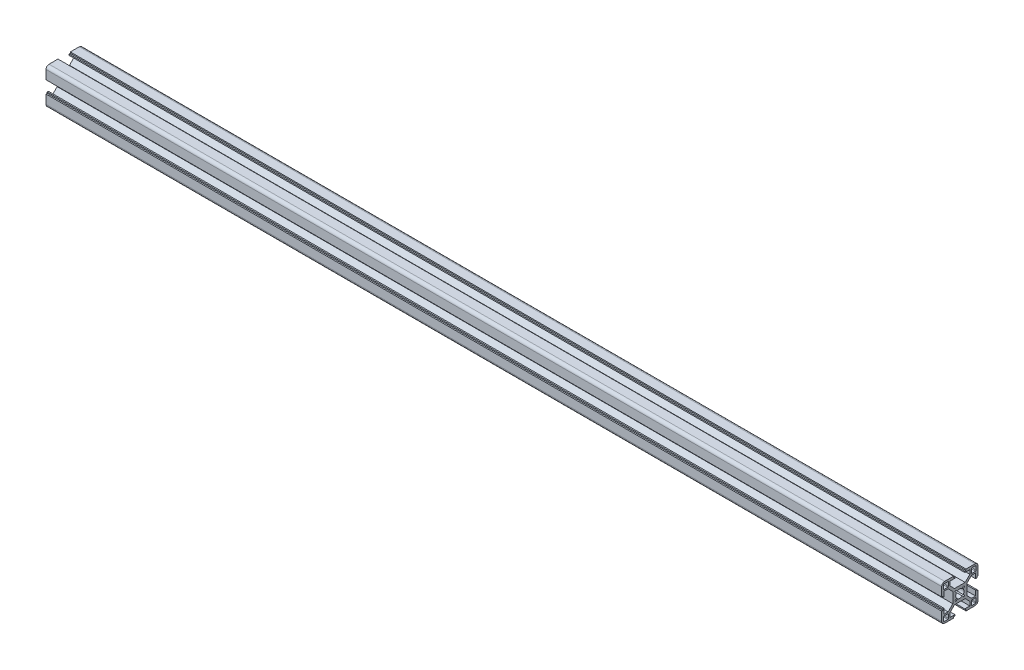
from build123d import *

# Parameters (mm, degrees)
EXTRUDE_1_DEPTH     = 50
EXTRUDE_2_DEPTH     = 740
CUT_EXTRUDE_START   = 15.049571
SKETCH_4_R          = 3
CUT_EXTRUDE_1_DEPTH = 30


with BuildPart() as part:
    # 草图1 → 凸台-拉伸1 (new body)
    with BuildSketch(Plane(origin=(0, 0, 0), x_dir=(0, 0, -1), z_dir=(1, 0, 0))):
        with BuildLine():
            Line((-5.14957074, -13.70467014), (-4.14957074, -13.70467014))
            Line((-4.14957074, -13.70467014), (-4.14957074, -12.70467014))
            Line((-4.14957074, -12.70467014), (-8.29957074, -12.70467014))
            Line((-8.29957074, -12.70467014), (-8.29957074, -9.3688837))
            Line((-8.29957074, -9.3688837), (-4.43535718, -5.50467014))
            Line((-4.43535718, -5.50467014), (4.3362157, -5.50467014))
            Line((4.3362157, -5.50467014), (8.20042926, -9.3688837))
            Line((8.20042926, -9.3688837), (8.20042926, -12.70467014))
            Line((8.20042926, -12.70467014), (4.05042926, -12.70467014))
            Line((4.05042926, -12.70467014), (4.05042926, -13.70467014))
            Line((4.05042926, -13.70467014), (5.05042926, -13.70467014))
            Line((5.05042926, -13.70467014), (5.05042926, -14.70467014))
            Line((5.05042926, -14.70467014), (12.45042926, -14.70467014))
            ThreePointArc((12.45042926, -14.70467014), (14.218196213, -13.972437093), (14.95042926, -12.20467014))
            Line((14.95042926, -12.20467014), (14.95042926, -4.80467014))
            Line((14.95042926, -4.80467014), (13.95042926, -4.80467014))
            Line((13.95042926, -4.80467014), (13.95042926, -3.80467014))
            Line((13.95042926, -3.80467014), (12.95042926, -3.80467014))
            Line((12.95042926, -3.80467014), (12.95042926, -7.95467014))
            Line((12.95042926, -7.95467014), (9.61464282, -7.95467014))
            Line((9.61464282, -7.95467014), (5.75042926, -4.09045658))
            Line((5.75042926, -4.09045658), (5.75042926, 4.6811163))
            Line((5.75042926, 4.6811163), (9.61464282, 8.54532986))
            Line((9.61464282, 8.54532986), (12.95042926, 8.54532986))
            Line((12.95042926, 8.54532986), (12.95042926, 4.39532986))
            Line((12.95042926, 4.39532986), (13.95042926, 4.39532986))
            Line((13.95042926, 4.39532986), (13.95042926, 5.39532986))
            Line((13.95042926, 5.39532986), (14.95042926, 5.39532986))
            Line((14.95042926, 5.39532986), (14.95042926, 12.79532986))
            ThreePointArc((14.95042926, 12.79532986), (14.218196213, 14.563096813), (12.45042926, 15.29532986))
            Line((12.45042926, 15.29532986), (5.05042926, 15.29532986))
            Line((5.05042926, 15.29532986), (5.05042926, 14.29532986))
            Line((5.05042926, 14.29532986), (4.05042926, 14.29532986))
            Line((4.05042926, 14.29532986), (4.05042926, 13.29532986))
            Line((4.05042926, 13.29532986), (8.20042926, 13.29532986))
            Line((8.20042926, 13.29532986), (8.20042926, 9.95954342))
            Line((8.20042926, 9.95954342), (4.3362157, 6.09532986))
            Line((4.3362157, 6.09532986), (-4.43535718, 6.09532986))
            Line((-4.43535718, 6.09532986), (-8.29957074, 9.95954342))
            Line((-8.29957074, 9.95954342), (-8.29957074, 13.29532986))
            Line((-8.29957074, 13.29532986), (-4.14957074, 13.29532986))
            Line((-4.14957074, 13.29532986), (-4.14957074, 14.29532986))
            Line((-4.14957074, 14.29532986), (-5.14957074, 14.29532986))
            Line((-5.14957074, 14.29532986), (-5.14957074, 15.29532986))
            Line((-5.14957074, 15.29532986), (-12.54957074, 15.29532986))
            ThreePointArc((-12.54957074, 15.29532986), (-14.317337693, 14.563096813), (-15.04957074, 12.79532986))
            Line((-15.04957074, 12.79532986), (-15.04957074, 5.39532986))
            Line((-15.04957074, 5.39532986), (-14.04957074, 5.39532986))
            Line((-14.04957074, 5.39532986), (-14.04957074, 4.39532986))
            Line((-14.04957074, 4.39532986), (-13.04957074, 4.39532986))
            Line((-13.04957074, 4.39532986), (-13.04957074, 8.54532986))
            Line((-13.04957074, 8.54532986), (-9.7137843, 8.54532986))
            Line((-9.7137843, 8.54532986), (-5.84957074, 4.6811163))
            Line((-5.84957074, 4.6811163), (-5.84957074, -4.09045658))
            Line((-5.84957074, -4.09045658), (-9.7137843, -7.95467014))
            Line((-9.7137843, -7.95467014), (-13.04957074, -7.95467014))
            Line((-13.04957074, -7.95467014), (-13.04957074, -3.80467014))
            Line((-13.04957074, -3.80467014), (-14.04957074, -3.80467014))
            Line((-14.04957074, -3.80467014), (-14.04957074, -4.80467014))
            Line((-14.04957074, -4.80467014), (-15.04957074, -4.80467014))
            Line((-15.04957074, -4.80467014), (-15.04957074, -12.20467014))
            ThreePointArc((-15.04957074, -12.20467014), (-14.317337693, -13.972437093), (-12.54957074, -14.70467014))
            Line((-12.54957074, -14.70467014), (-5.14957074, -14.70467014))
            Line((-5.14957074, -14.70467014), (-5.14957074, -13.70467014))
        make_face()
        with BuildLine():
            Line((-10.04957074, 9.79532986), (-13.04957074, 9.79532986))
            ThreePointArc((-13.04957074, 9.79532986), (-13.403124131, 9.941776469), (-13.54957074, 10.29532986))
            Line((-13.54957074, 10.29532986), (-13.54957074, 13.29532986))
            ThreePointArc((-13.54957074, 13.29532986), (-13.403124131, 13.648883251), (-13.04957074, 13.79532986))
            Line((-13.04957074, 13.79532986), (-10.04957074, 13.79532986))
            ThreePointArc((-10.04957074, 13.79532986), (-9.696017349, 13.648883251), (-9.54957074, 13.29532986))
            Line((-9.54957074, 13.29532986), (-9.54957074, 10.29532986))
            ThreePointArc((-9.54957074, 10.29532986), (-9.696017349, 9.941776469), (-10.04957074, 9.79532986))
        make_face(mode=Mode.SUBTRACT)
        with BuildLine():
            Line((-10.04957074, -13.20467014), (-13.04957074, -13.20467014))
            ThreePointArc((-13.04957074, -13.20467014), (-13.403124131, -13.058223531), (-13.54957074, -12.70467014))
            Line((-13.54957074, -12.70467014), (-13.54957074, -9.70467014))
            ThreePointArc((-13.54957074, -9.70467014), (-13.403124131, -9.351116749), (-13.04957074, -9.20467014))
            Line((-13.04957074, -9.20467014), (-10.04957074, -9.20467014))
            ThreePointArc((-10.04957074, -9.20467014), (-9.696017349, -9.351116749), (-9.54957074, -9.70467014))
            Line((-9.54957074, -9.70467014), (-9.54957074, -12.70467014))
            ThreePointArc((-9.54957074, -12.70467014), (-9.696017349, -13.058223531), (-10.04957074, -13.20467014))
        make_face(mode=Mode.SUBTRACT)
        with BuildLine():
            Line((12.95042926, 9.79532986), (9.95042926, 9.79532986))
            ThreePointArc((9.95042926, 9.79532986), (9.596875869, 9.941776469), (9.45042926, 10.29532986))
            Line((9.45042926, 10.29532986), (9.45042926, 13.29532986))
            ThreePointArc((9.45042926, 13.29532986), (9.596875869, 13.648883251), (9.95042926, 13.79532986))
            Line((9.95042926, 13.79532986), (12.95042926, 13.79532986))
            ThreePointArc((12.95042926, 13.79532986), (13.303982651, 13.648883251), (13.45042926, 13.29532986))
            Line((13.45042926, 13.29532986), (13.45042926, 10.29532986))
            ThreePointArc((13.45042926, 10.29532986), (13.303982651, 9.941776469), (12.95042926, 9.79532986))
        make_face(mode=Mode.SUBTRACT)
        with BuildLine():
            Line((13.45042926, -9.70467014), (13.45042926, -12.70467014))
            ThreePointArc((13.45042926, -12.70467014), (13.303982651, -13.058223531), (12.95042926, -13.20467014))
            Line((12.95042926, -13.20467014), (9.95042926, -13.20467014))
            ThreePointArc((9.95042926, -13.20467014), (9.596875869, -13.058223531), (9.45042926, -12.70467014))
            Line((9.45042926, -12.70467014), (9.45042926, -9.70467014))
            ThreePointArc((9.45042926, -9.70467014), (9.596875869, -9.351116749), (9.95042926, -9.20467014))
            Line((9.95042926, -9.20467014), (12.95042926, -9.20467014))
            ThreePointArc((12.95042926, -9.20467014), (13.303982651, -9.351116749), (13.45042926, -9.70467014))
        make_face(mode=Mode.SUBTRACT)
        with BuildLine():
            Line((-4.07998961, 3.61864195), (-3.37288283, 4.32574873))
            Line((-3.37288283, 4.32574873), (-2.07404174, 3.02690764))
            ThreePointArc((-2.07404174, 3.02690764), (-0.04957074, 3.69532986), (1.97490026, 3.02690764))
            Line((1.97490026, 3.02690764), (3.27374135, 4.32574873))
            Line((3.27374135, 4.32574873), (3.98084813, 3.61864195))
            Line((3.98084813, 3.61864195), (2.68200704, 2.31980086))
            ThreePointArc((2.68200704, 2.31980086), (3.35042926, 0.29532986), (2.68200704, -1.72914114))
            Line((2.68200704, -1.72914114), (3.98084813, -3.02798223))
            Line((3.98084813, -3.02798223), (3.27374135, -3.73508901))
            Line((3.27374135, -3.73508901), (1.97490026, -2.43624792))
            ThreePointArc((1.97490026, -2.43624792), (-0.04957074, -3.10467014), (-2.07404174, -2.43624792))
            Line((-2.07404174, -2.43624792), (-3.37288283, -3.73508901))
            Line((-3.37288283, -3.73508901), (-4.07998961, -3.02798223))
            Line((-4.07998961, -3.02798223), (-2.78114852, -1.72914114))
            ThreePointArc((-2.78114852, -1.72914114), (-3.44957074, 0.29532986), (-2.78114852, 2.31980086))
            Line((-2.78114852, 2.31980086), (-4.07998961, 3.61864195))
        make_face(mode=Mode.SUBTRACT)
    extrude(amount=-EXTRUDE_1_DEPTH)

    # 草图2 → 凸台-拉伸2 (add)
    with BuildSketch(Plane(origin=(0, 0, 0), x_dir=(0, 0, -1), z_dir=(1, 0, 0))):
        with BuildLine():
            Line((-15.04957074, -4.80467014), (-15.04957074, -12.20467014))
            ThreePointArc((-15.04957074, -12.20467014), (-14.317337693, -13.972437093), (-12.54957074, -14.70467014))
            Line((-12.54957074, -14.70467014), (-5.14957074, -14.70467014))
            Line((-5.14957074, -14.70467014), (-5.14957074, -13.70467014))
            Line((-5.14957074, -13.70467014), (-4.14957074, -13.70467014))
            Line((-4.14957074, -13.70467014), (-4.14957074, -12.70467014))
            Line((-4.14957074, -12.70467014), (-8.29957074, -12.70467014))
            Line((-8.29957074, -12.70467014), (-8.29957074, -9.3688837))
            Line((-8.29957074, -9.3688837), (-4.43535718, -5.50467014))
            Line((-4.43535718, -5.50467014), (4.3362157, -5.50467014))
            Line((4.3362157, -5.50467014), (8.20042926, -9.3688837))
            Line((8.20042926, -9.3688837), (8.20042926, -12.70467014))
            Line((8.20042926, -12.70467014), (4.05042926, -12.70467014))
            Line((4.05042926, -12.70467014), (4.05042926, -13.70467014))
            Line((4.05042926, -13.70467014), (5.05042926, -13.70467014))
            Line((5.05042926, -13.70467014), (5.05042926, -14.70467014))
            Line((5.05042926, -14.70467014), (12.45042926, -14.70467014))
            ThreePointArc((12.45042926, -14.70467014), (14.218196213, -13.972437093), (14.95042926, -12.20467014))
            Line((14.95042926, -12.20467014), (14.95042926, -4.80467014))
            Line((14.95042926, -4.80467014), (13.95042926, -4.80467014))
            Line((13.95042926, -4.80467014), (13.95042926, -3.80467014))
            Line((13.95042926, -3.80467014), (12.95042926, -3.80467014))
            Line((12.95042926, -3.80467014), (12.95042926, -7.95467014))
            Line((12.95042926, -7.95467014), (9.61464282, -7.95467014))
            Line((9.61464282, -7.95467014), (5.75042926, -4.09045658))
            Line((5.75042926, -4.09045658), (5.75042926, 4.6811163))
            Line((5.75042926, 4.6811163), (9.61464282, 8.54532986))
            Line((9.61464282, 8.54532986), (12.95042926, 8.54532986))
            Line((12.95042926, 8.54532986), (12.95042926, 4.39532986))
            Line((12.95042926, 4.39532986), (13.95042926, 4.39532986))
            Line((13.95042926, 4.39532986), (13.95042926, 5.39532986))
            Line((13.95042926, 5.39532986), (14.95042926, 5.39532986))
            Line((14.95042926, 5.39532986), (14.95042926, 12.79532986))
            ThreePointArc((14.95042926, 12.79532986), (14.218196213, 14.563096813), (12.45042926, 15.29532986))
            Line((12.45042926, 15.29532986), (5.05042926, 15.29532986))
            Line((5.05042926, 15.29532986), (5.05042926, 14.29532986))
            Line((5.05042926, 14.29532986), (4.05042926, 14.29532986))
            Line((4.05042926, 14.29532986), (4.05042926, 13.29532986))
            Line((4.05042926, 13.29532986), (8.20042926, 13.29532986))
            Line((8.20042926, 13.29532986), (8.20042926, 9.95954342))
            Line((8.20042926, 9.95954342), (4.3362157, 6.09532986))
            Line((4.3362157, 6.09532986), (-4.43535718, 6.09532986))
            Line((-4.43535718, 6.09532986), (-8.29957074, 9.95954342))
            Line((-8.29957074, 9.95954342), (-8.29957074, 13.29532986))
            Line((-8.29957074, 13.29532986), (-4.14957074, 13.29532986))
            Line((-4.14957074, 13.29532986), (-4.14957074, 14.29532986))
            Line((-4.14957074, 14.29532986), (-5.14957074, 14.29532986))
            Line((-5.14957074, 14.29532986), (-5.14957074, 15.29532986))
            Line((-5.14957074, 15.29532986), (-12.54957074, 15.29532986))
            ThreePointArc((-12.54957074, 15.29532986), (-14.317337693, 14.563096813), (-15.04957074, 12.79532986))
            Line((-15.04957074, 12.79532986), (-15.04957074, 5.39532986))
            Line((-15.04957074, 5.39532986), (-14.04957074, 5.39532986))
            Line((-14.04957074, 5.39532986), (-14.04957074, 4.39532986))
            Line((-14.04957074, 4.39532986), (-13.04957074, 4.39532986))
            Line((-13.04957074, 4.39532986), (-13.04957074, 8.54532986))
            Line((-13.04957074, 8.54532986), (-9.7137843, 8.54532986))
            Line((-9.7137843, 8.54532986), (-5.84957074, 4.6811163))
            Line((-5.84957074, 4.6811163), (-5.84957074, -4.09045658))
            Line((-5.84957074, -4.09045658), (-9.7137843, -7.95467014))
            Line((-9.7137843, -7.95467014), (-13.04957074, -7.95467014))
            Line((-13.04957074, -7.95467014), (-13.04957074, -3.80467014))
            Line((-13.04957074, -3.80467014), (-14.04957074, -3.80467014))
            Line((-14.04957074, -3.80467014), (-14.04957074, -4.80467014))
            Line((-14.04957074, -4.80467014), (-15.04957074, -4.80467014))
        make_face()
        with BuildLine():
            Line((-13.04957074, 9.79532986), (-10.04957074, 9.79532986))
            ThreePointArc((-10.04957074, 9.79532986), (-9.696017349, 9.941776469), (-9.54957074, 10.29532986))
            Line((-9.54957074, 10.29532986), (-9.54957074, 13.29532986))
            ThreePointArc((-9.54957074, 13.29532986), (-9.696017349, 13.648883251), (-10.04957074, 13.79532986))
            Line((-10.04957074, 13.79532986), (-13.04957074, 13.79532986))
            ThreePointArc((-13.04957074, 13.79532986), (-13.403124131, 13.648883251), (-13.54957074, 13.29532986))
            Line((-13.54957074, 13.29532986), (-13.54957074, 10.29532986))
            ThreePointArc((-13.54957074, 10.29532986), (-13.403124131, 9.941776469), (-13.04957074, 9.79532986))
        make_face(mode=Mode.SUBTRACT)
        with BuildLine():
            Line((-13.04957074, -13.20467014), (-10.04957074, -13.20467014))
            ThreePointArc((-10.04957074, -13.20467014), (-9.696017349, -13.058223531), (-9.54957074, -12.70467014))
            Line((-9.54957074, -12.70467014), (-9.54957074, -9.70467014))
            ThreePointArc((-9.54957074, -9.70467014), (-9.696017349, -9.351116749), (-10.04957074, -9.20467014))
            Line((-10.04957074, -9.20467014), (-13.04957074, -9.20467014))
            ThreePointArc((-13.04957074, -9.20467014), (-13.403124131, -9.351116749), (-13.54957074, -9.70467014))
            Line((-13.54957074, -9.70467014), (-13.54957074, -12.70467014))
            ThreePointArc((-13.54957074, -12.70467014), (-13.403124131, -13.058223531), (-13.04957074, -13.20467014))
        make_face(mode=Mode.SUBTRACT)
        with BuildLine():
            Line((9.45042926, 13.29532986), (9.45042926, 10.29532986))
            ThreePointArc((9.45042926, 10.29532986), (9.596875869, 9.941776469), (9.95042926, 9.79532986))
            Line((9.95042926, 9.79532986), (12.95042926, 9.79532986))
            ThreePointArc((12.95042926, 9.79532986), (13.303982651, 9.941776469), (13.45042926, 10.29532986))
            Line((13.45042926, 10.29532986), (13.45042926, 13.29532986))
            ThreePointArc((13.45042926, 13.29532986), (13.303982651, 13.648883251), (12.95042926, 13.79532986))
            Line((12.95042926, 13.79532986), (9.95042926, 13.79532986))
            ThreePointArc((9.95042926, 13.79532986), (9.596875869, 13.648883251), (9.45042926, 13.29532986))
        make_face(mode=Mode.SUBTRACT)
        with BuildLine():
            Line((9.45042926, -9.70467014), (9.45042926, -12.70467014))
            ThreePointArc((9.45042926, -12.70467014), (9.596875869, -13.058223531), (9.95042926, -13.20467014))
            Line((9.95042926, -13.20467014), (12.95042926, -13.20467014))
            ThreePointArc((12.95042926, -13.20467014), (13.303982651, -13.058223531), (13.45042926, -12.70467014))
            Line((13.45042926, -12.70467014), (13.45042926, -9.70467014))
            ThreePointArc((13.45042926, -9.70467014), (13.303982651, -9.351116749), (12.95042926, -9.20467014))
            Line((12.95042926, -9.20467014), (9.95042926, -9.20467014))
            ThreePointArc((9.95042926, -9.20467014), (9.596875869, -9.351116749), (9.45042926, -9.70467014))
        make_face(mode=Mode.SUBTRACT)
        with BuildLine():
            Line((-3.37288283, -3.73508901), (-2.07404174, -2.43624792))
            ThreePointArc((-2.07404174, -2.43624792), (-0.04957074, -3.10467014), (1.97490026, -2.43624792))
            Line((1.97490026, -2.43624792), (3.27374135, -3.73508901))
            Line((3.27374135, -3.73508901), (3.98084813, -3.02798223))
            Line((3.98084813, -3.02798223), (2.68200704, -1.72914114))
            ThreePointArc((2.68200704, -1.72914114), (3.35042926, 0.29532986), (2.68200704, 2.31980086))
            Line((2.68200704, 2.31980086), (3.98084813, 3.61864195))
            Line((3.98084813, 3.61864195), (3.27374135, 4.32574873))
            Line((3.27374135, 4.32574873), (1.97490026, 3.02690764))
            ThreePointArc((1.97490026, 3.02690764), (-0.04957074, 3.69532986), (-2.07404174, 3.02690764))
            Line((-2.07404174, 3.02690764), (-3.37288283, 4.32574873))
            Line((-3.37288283, 4.32574873), (-4.07998961, 3.61864195))
            Line((-4.07998961, 3.61864195), (-2.78114852, 2.31980086))
            ThreePointArc((-2.78114852, 2.31980086), (-3.44957074, 0.29532986), (-2.78114852, -1.72914114))
            Line((-2.78114852, -1.72914114), (-4.07998961, -3.02798223))
            Line((-4.07998961, -3.02798223), (-3.37288283, -3.73508901))
        make_face(mode=Mode.SUBTRACT)
    extrude(amount=-EXTRUDE_2_DEPTH)

    # 草图4 → 切除-拉伸1 (cut)
    with BuildSketch(Plane.XY.offset(CUT_EXTRUDE_START)):
        with Locations(Location((-726.5, 0, 0), (0, 0, 324.803641529))):
            Circle(SKETCH_4_R)
        with Locations(Location((-13.5, 0, 0), (0, 0, 324.803641529))):
            Circle(SKETCH_4_R)
    extrude(amount=-CUT_EXTRUDE_1_DEPTH, mode=Mode.SUBTRACT)


solid = part.part
